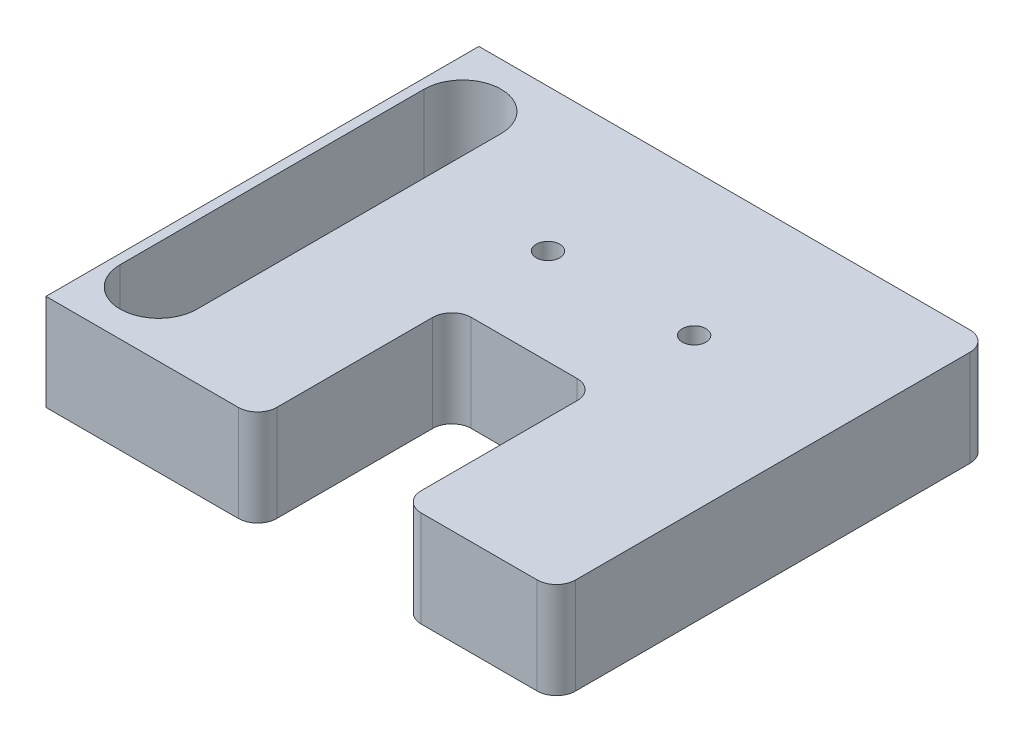
from build123d import *

# Parameters (mm, degrees)
BOSS_EXTRUDE1_DEPTH     = 10
FILLET1_R               = 2
FILLET2_R               = 2
FILLET3_R               = 2
FILLET4_R               = 2
FILLET5_R               = 2
FILLET6_R               = 2
CUT_EXTRUDE3_DEPTH      = 55.419825047
CUT_EXTRUDE3_DEPTH_BACK = 55.419825047
SKETCH4_R               = 1.225
CUT_EXTRUDE4_DEPTH      = 10


with BuildPart() as part:
    # Sketch1 → Boss-Extrude1 (new body)
    with BuildSketch(Plane(origin=(0, 0, 0), x_dir=(1, 0, 0), z_dir=(0, 1, 0))):
        Polygon((-28.953703704, 0), (24.076296296, 0), (24.076296296, -44.98), (8.026296296, -44.98), (8.026296296, -24.78), (-6.973703704, -24.78), (-6.973703704, -44.98), (-28.953703704, -44.98), align=None)
    extrude(amount=BOSS_EXTRUDE1_DEPTH)

    # Fillet1
    fillet1_edges = [part.edges().sort_by_distance(p)[0] for p in [
        (-6.973703704, 5, 24.78),
    ]]
    fillet(fillet1_edges, radius=FILLET1_R)

    # Fillet2
    fillet2_edges = [part.edges().sort_by_distance(p)[0] for p in [
        (8.026296296, 5, 24.78),
    ]]
    fillet(fillet2_edges, radius=FILLET2_R)

    # Fillet3
    fillet3_edges = [part.edges().sort_by_distance(p)[0] for p in [
        (-6.973703704, 5, 44.98),
    ]]
    fillet(fillet3_edges, radius=FILLET3_R)

    # Fillet4
    fillet4_edges = [part.edges().sort_by_distance(p)[0] for p in [
        (8.026296296, 5, 44.98),
    ]]
    fillet(fillet4_edges, radius=FILLET4_R)

    # Fillet5
    fillet5_edges = [part.edges().sort_by_distance(p)[0] for p in [
        (24.076296296, 5, 0),
    ]]
    fillet(fillet5_edges, radius=FILLET5_R)

    # Fillet6
    fillet6_edges = [part.edges().sort_by_distance(p)[0] for p in [
        (24.076296296, 5, 44.98),
    ]]
    fillet(fillet6_edges, radius=FILLET6_R)

    # Sketch4 → Cut-Extrude3 (cut, two sides: drawn at the far end of the back side and taken through both)
    with BuildSketch(Plane(origin=(0, 10, 0), x_dir=(1, 0, 0), z_dir=(0, 1, 0)).offset(-CUT_EXTRUDE3_DEPTH_BACK)):
        with Locations(Location((-6.958703704, -14.825, 0), (0, 0, 270))):
            Circle(SKETCH4_R)
        with Locations(Location((8.231296296, -14.825, 0), (0, 0, 270))):
            Circle(SKETCH4_R)
    extrude(amount=CUT_EXTRUDE3_DEPTH + CUT_EXTRUDE3_DEPTH_BACK, mode=Mode.SUBTRACT)

    # Sketch2 → Cut-Extrude4 (cut)
    with BuildSketch(Plane(origin=(0, 10, 0), x_dir=(1, 0, 0), z_dir=(0, 1, 0))):
        with BuildLine():
            Line((-27.953703704, -6.7), (-27.953703704, -38.28))
            ThreePointArc((-27.953703704, -38.28), (-23.953703704, -42.28), (-19.953703704, -38.28))
            Line((-19.953703704, -38.28), (-19.953703704, -6.7))
            ThreePointArc((-19.953703704, -6.7), (-23.953703704, -2.7), (-27.953703704, -6.7))
        make_face()
    extrude(amount=-CUT_EXTRUDE4_DEPTH, mode=Mode.SUBTRACT)


solid = part.part
